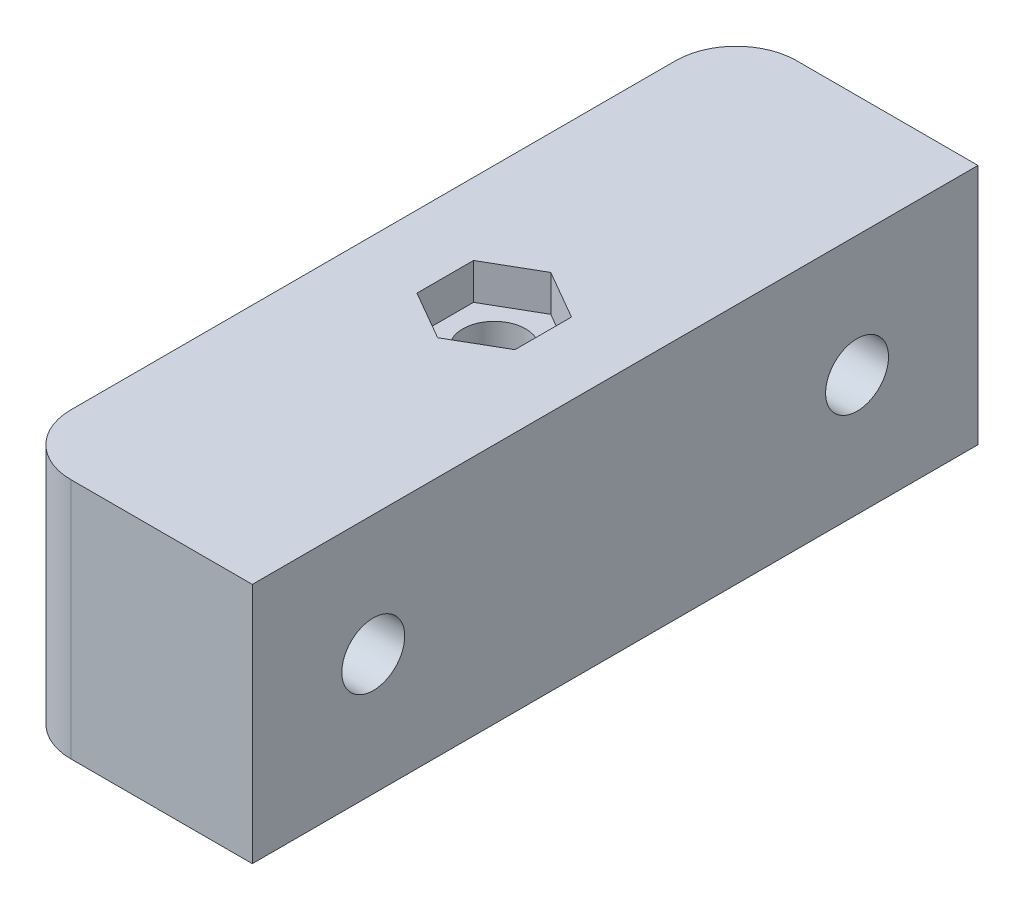
from build123d import *

# Parameters (mm, degrees)
BOSS_EXTRUDE1_DEPTH = 20
SKETCH4_R           = 2.6
CUT_EXTRUDE1_DEPTH  = 42.231056256
CUT_EXTRUDE2_DEPTH  = 3
CUT_EXTRUDE3_DEPTH  = 8
SKETCH7_R           = 2.6
CUT_EXTRUDE4_DEPTH  = 42.231056256
FILLET1_R           = 5


with BuildPart() as part:
    # Sketch1 → Boss-Extrude1 (new body)
    with BuildSketch(Plane(origin=(0, 0, 0), x_dir=(1, 0, 0), z_dir=(0, 1, 0))):
        Polygon((0, 0), (0, 30), (-20, 30), (-20, -30), (0, -30), align=None)
    extrude(amount=BOSS_EXTRUDE1_DEPTH)

    # Sketch4 → Cut-Extrude1 (cut, through all)
    with BuildSketch(Plane(origin=(0, 20, 0), x_dir=(1, 0, 0), z_dir=(0, 1, 0))):
        with Locations(Location((-10, 0, 0), (0, 0, 270))):
            Circle(SKETCH4_R)
    extrude(amount=-CUT_EXTRUDE1_DEPTH, mode=Mode.SUBTRACT)

    # Sketch5 → Cut-Extrude2 (cut)
    with BuildSketch(Plane(origin=(0, 20, 0), x_dir=(1, 0, 0), z_dir=(0, 1, 0))):
        Polygon((-10, 4.67653718), (-14.05, 2.33826859), (-14.05, -2.33826859), (-10, -4.67653718), (-5.95, -2.33826859), (-5.95, 2.33826859), align=None)
    extrude(amount=-CUT_EXTRUDE2_DEPTH, mode=Mode.SUBTRACT)

    # Sketch6 → Cut-Extrude3 (cut)
    with BuildSketch(Plane.XZ):
        Polygon((-10, -4.67653718), (-5.95, -2.33826859), (-5.95, 2.33826859), (-10, 4.67653718), (-14.05, 2.33826859), (-14.05, -2.33826859), align=None)
    extrude(amount=-CUT_EXTRUDE3_DEPTH, mode=Mode.SUBTRACT)

    # Sketch7 → Cut-Extrude4 (cut, through all)
    with BuildSketch(Plane(origin=(0, 0, 0), x_dir=(0, 0, -1), z_dir=(1, 0, 0))):
        with Locations((-20, 10)):
            Circle(SKETCH7_R)
        with Locations((20, 10)):
            Circle(SKETCH7_R)
    extrude(amount=-CUT_EXTRUDE4_DEPTH, mode=Mode.SUBTRACT)

    # Fillet1
    fillet1_edges = [part.edges().sort_by_distance(p)[0] for p in [
        (-20, 10, 30),
        (-20, 10, -30),
    ]]
    fillet(fillet1_edges, radius=FILLET1_R)


solid = part.part
